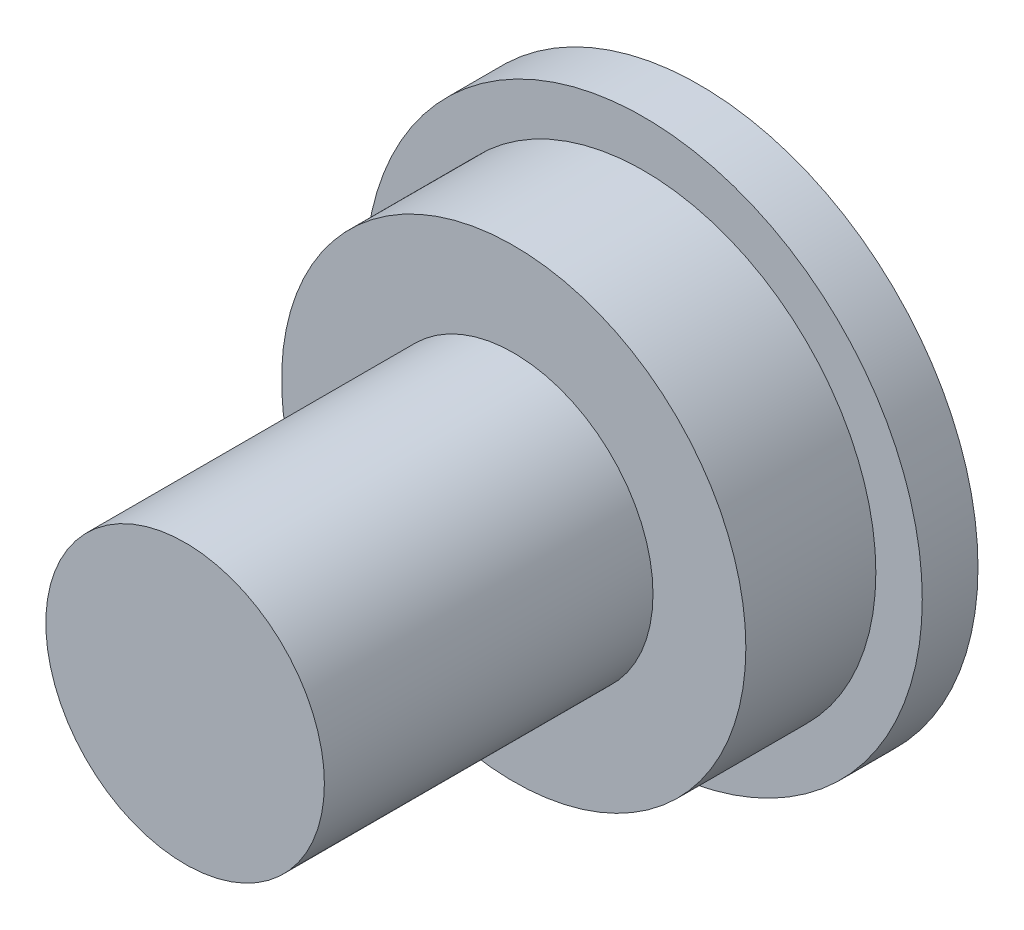
from build123d import *

# Parameters (mm, degrees)
SKETCH2_R           = 15
BOSS_EXTRUDE1_DEPTH = 10
CUT_EXTRUDE1_START  = -7
SKETCH3_R           = 15
SKETCH3_R_2         = 12.5
CUT_EXTRUDE1_DEPTH  = 7
SKETCH4_R           = 7.5
BOSS_EXTRUDE4_DEPTH = 17.695


with BuildPart() as part:
    # Sketch2 → Boss-Extrude1 (new body)
    with BuildSketch(Plane.XY):
        Circle(SKETCH2_R)
    extrude(amount=BOSS_EXTRUDE1_DEPTH)

    # Sketch3 → Cut-Extrude1 (cut)
    with BuildSketch(Plane.XY.offset(10).offset(CUT_EXTRUDE1_START)):
        Circle(SKETCH3_R)
        Circle(SKETCH3_R_2, mode=Mode.SUBTRACT)
    extrude(amount=CUT_EXTRUDE1_DEPTH, mode=Mode.SUBTRACT)

    # Sketch4 → Boss-Extrude4 (add)
    with BuildSketch(Plane.XY.offset(10)):
        Circle(SKETCH4_R)
    extrude(amount=BOSS_EXTRUDE4_DEPTH)


solid = part.part
